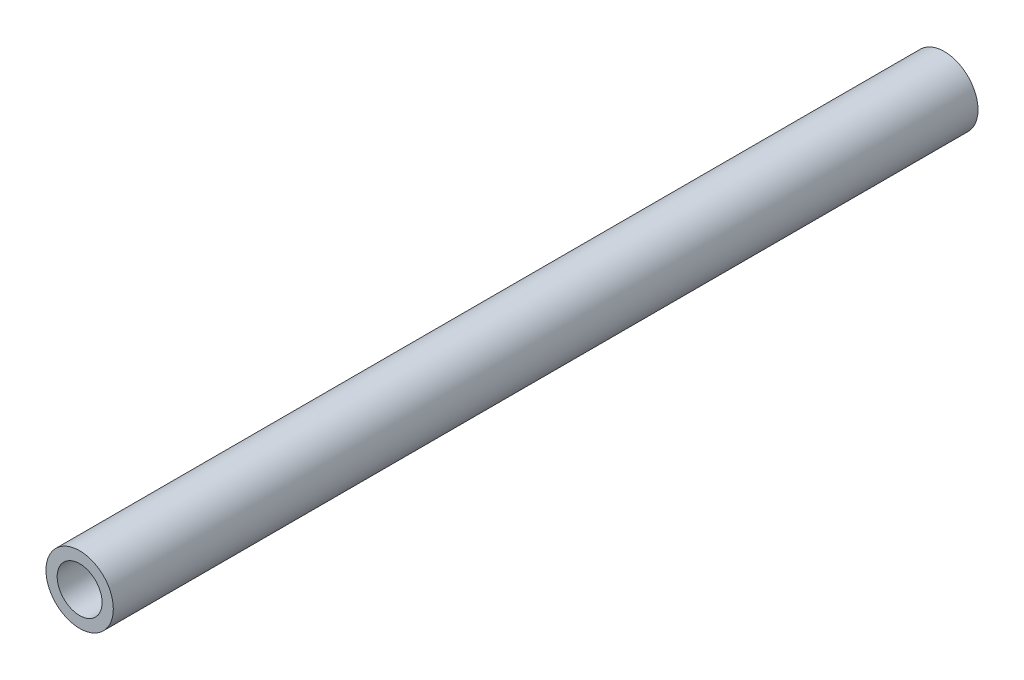
from build123d import *

# Parameters (mm, degrees)
SKETCH1_R           = 19.05
BOSS_EXTRUDE1_DEPTH = 488.95
SKETCH2_R           = 12.7
CUT_EXTRUDE1_DEPTH  = 539.75


with BuildPart() as part:
    # Sketch1 → Boss-Extrude1 (new body)
    with BuildSketch(Plane.XY):
        Circle(SKETCH1_R)
    extrude(amount=BOSS_EXTRUDE1_DEPTH)

    # Sketch2 → Cut-Extrude1 (cut)
    with BuildSketch(Plane.XY.offset(488.95)):
        Circle(SKETCH2_R)
    extrude(amount=-CUT_EXTRUDE1_DEPTH, mode=Mode.SUBTRACT)


solid = part.part
